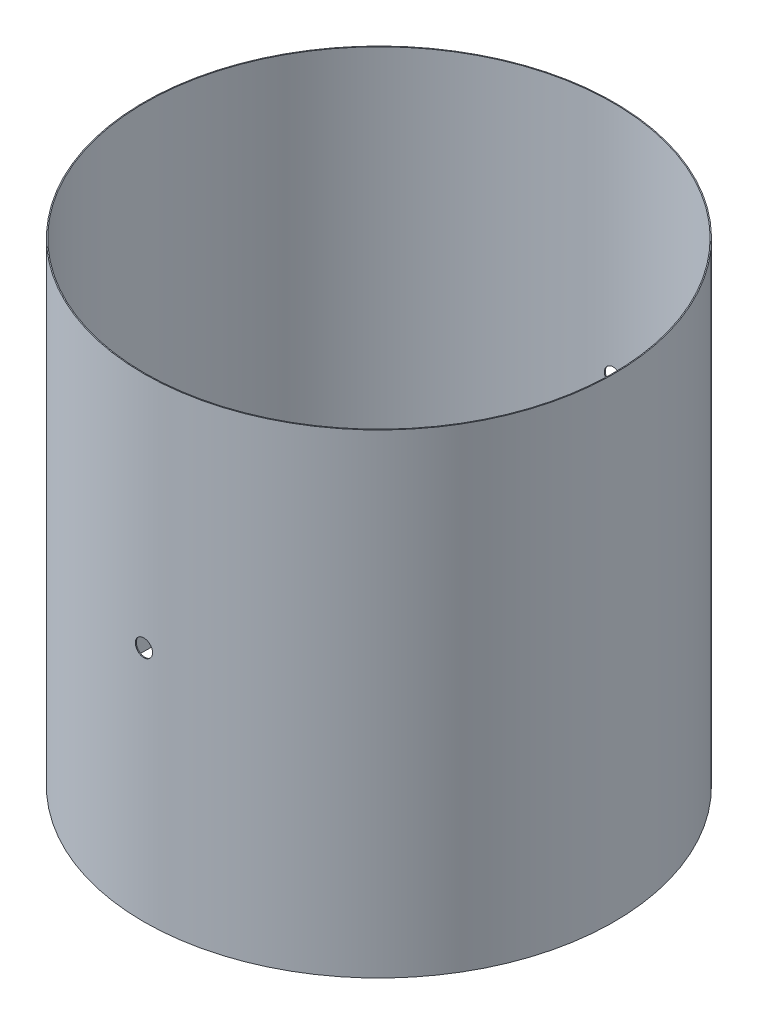
from build123d import *

# Parameters (mm, degrees)
SKETCH1_R               = 376.5
SKETCH1_R_2             = 375
BOSS_EXTRUDE1_DEPTH     = 380
CUT_EXTRUDE1_DEPTH      = 655.144097275
CUT_EXTRUDE1_DEPTH_BACK = 655.144097275
SKETCH2_R               = 13.75


with BuildPart() as part:
    # Sketch1 → Boss-Extrude1 (new, symmetric)
    with BuildSketch(Plane(origin=(0, 0, 0), x_dir=(1, 0, 0), z_dir=(0, 1, 0))):
        with Locations(Location((0, 0, 0), (0, 0, 270))):
            Circle(SKETCH1_R)
        with Locations(Location((0, 0, 0), (0, 0, 270))):
            Circle(SKETCH1_R_2, mode=Mode.SUBTRACT)
    extrude(amount=BOSS_EXTRUDE1_DEPTH, both=True)

    # Sketch2 → Cut-Extrude1 (cut, two sides: drawn at the far end of the back side and taken through both)
    with BuildSketch(Plane.XY.offset(-CUT_EXTRUDE1_DEPTH_BACK)):
        Circle(SKETCH2_R)
    extrude(amount=CUT_EXTRUDE1_DEPTH + CUT_EXTRUDE1_DEPTH_BACK, mode=Mode.SUBTRACT)


solid = part.part
